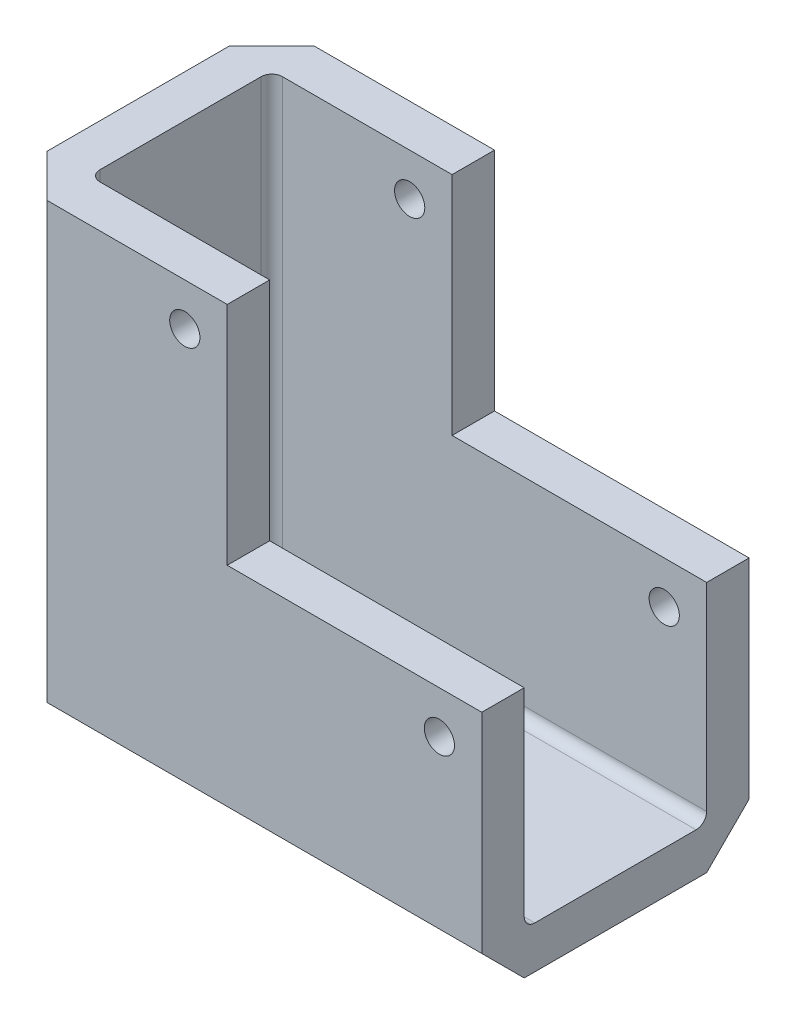
from build123d import *

# Parameters (mm, degrees)
SALIENTE_EXTRUIR1_DEPTH = 4
CROQUIS2_W              = 17.2
CROQUIS2_H              = 41
CROQUIS2_W_2            = 4
SALIENTE_EXTRUIR2_DEPTH = 4
CROQUIS3_W              = 45
CROQUIS3_H              = 21.2
SALIENTE_EXTRUIR3_DEPTH = 4
SALIENTE_EXTRUIR4_DEPTH = 4
REDONDEO1_R             = 1
CHAFL_N1_SIZE           = 4
CROQUIS6_R              = 1.425
CORTAR_EXTRUIR2_DEPTH   = 43.103800304


with BuildPart() as part:
    # Croquis1 → Saliente-Extruir1 (new body)
    with BuildSketch(Plane.XY):
        Polygon((0, 0), (0, 21.3), (-17, 21.3), (-17, -19.7), (24, -19.7), (24, 0), align=None)
    extrude(amount=SALIENTE_EXTRUIR1_DEPTH)

    # Croquis2 → Saliente-Extruir2 (add)
    with BuildSketch(Plane.ZY.offset(17)):
        with Locations((-8.6, 0.8)):
            Rectangle(CROQUIS2_W, CROQUIS2_H)
        with Locations((2, 0.8)):
            Rectangle(CROQUIS2_W_2, CROQUIS2_H)
    extrude(amount=SALIENTE_EXTRUIR2_DEPTH)

    # Croquis3 → Saliente-Extruir3 (add)
    with BuildSketch(Plane.XZ.offset(19.7)):
        with Locations((1.5, -6.6)):
            Rectangle(CROQUIS3_W, CROQUIS3_H)
    extrude(amount=SALIENTE_EXTRUIR3_DEPTH)

    # Croquis4 → Saliente-Extruir4 (add)
    with BuildSketch(Plane(origin=(0, 0, -17.2), x_dir=(-1, 0, 0), z_dir=(0, 0, -1))):
        Polygon((-24, -23.7), (-24, 0), (0, 0), (0, 21.3), (21, 21.3), (21, -23.7), align=None)
    extrude(amount=SALIENTE_EXTRUIR4_DEPTH)

    # Redondeo1
    redondeo1_edges = [part.edges().sort_by_distance(p)[0] for p in [
        (-17, -19.7, -8.6),
        (-17, 0.8, -17.2),
        (3.5, -19.7, -17.2),
        (3.5, -19.7, 0),
        (-17, 0.8, 0),
    ]]
    fillet(redondeo1_edges, radius=REDONDEO1_R)

    # Chaflán1
    chafl_n1_edges = [part.edges().sort_by_distance(p)[0] for p in [
        (-21, -1.2, 4),
        (1.5, -23.7, 4),
        (1.5, -23.7, -21.2),
        (-21, -1.2, -21.2),
    ]]
    chamfer(chafl_n1_edges, length=CHAFL_N1_SIZE)

    # Croquis6 → Cortar-Extruir2 (cut, through all)
    with BuildSketch(Plane(origin=(0, 0, -21.2), x_dir=(-1, 0, 0), z_dir=(0, 0, -1))):
        with Locations(Location((-20, -4, 0), (0, 0, 90))):
            Circle(CROQUIS6_R)
        with Locations(Location((4, 17.3, 0), (0, 0, 90))):
            Circle(CROQUIS6_R)
    extrude(amount=-CORTAR_EXTRUIR2_DEPTH, mode=Mode.SUBTRACT)


solid = part.part
